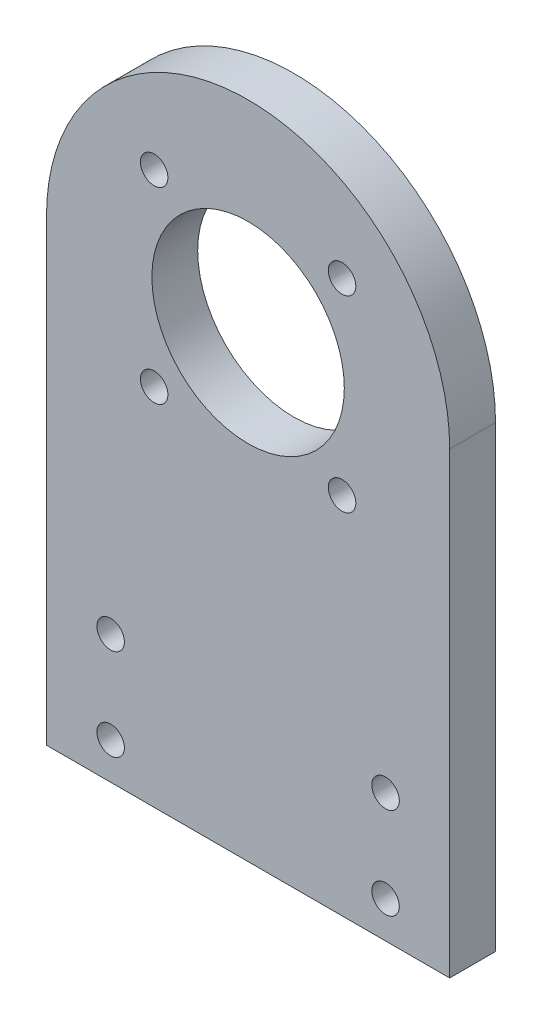
from build123d import *

# Parameters (mm, degrees)
SKETCH_1_R          = 1.5
SKETCH_1_R_2        = 10.5
EXTRUDE_1_DEPTH     = 5
SKETCH_2_R          = 1.5
CUT_EXTRUDE_1_DEPTH = 76.451971479


with BuildPart() as part:
    # 草图1 → 凸台-拉伸1 (new body)
    with BuildSketch(Plane.XY):
        with BuildLine():
            Line((-22, 0), (22, 0))
            Line((22, 0), (22, 50))
            ThreePointArc((22, 50), (0, 72), (-22, 50))
            Line((-22, 50), (-22, 0))
        make_face()
        with Locations((-15, 14)):
            Circle(SKETCH_1_R, mode=Mode.SUBTRACT)
        with Locations((-15, 4)):
            Circle(SKETCH_1_R, mode=Mode.SUBTRACT)
        with Locations(Location((15, 4, 0), (0, 0, 180))):
            Circle(SKETCH_1_R, mode=Mode.SUBTRACT)
        with Locations(Location((15, 14, 0), (0, 0, 180))):
            Circle(SKETCH_1_R, mode=Mode.SUBTRACT)
        with Locations((0, 50)):
            Circle(SKETCH_1_R_2, mode=Mode.SUBTRACT)
    extrude(amount=EXTRUDE_1_DEPTH)

    # 草图2 → 切除-拉伸1 (cut, through all)
    with BuildSketch(Plane(origin=(0, 0, 0), x_dir=(-1, 0, 0), z_dir=(0, 0, -1))):
        with Locations((10.253048327, 60.253048327)):
            Circle(SKETCH_2_R)
        with Locations((10.253048327, 39.746951673)):
            Circle(SKETCH_2_R)
        with Locations((-10.253048327, 39.746951673)):
            Circle(SKETCH_2_R)
        with Locations((-10.253048327, 60.253048327)):
            Circle(SKETCH_2_R)
    extrude(amount=-CUT_EXTRUDE_1_DEPTH, mode=Mode.SUBTRACT)


solid = part.part
